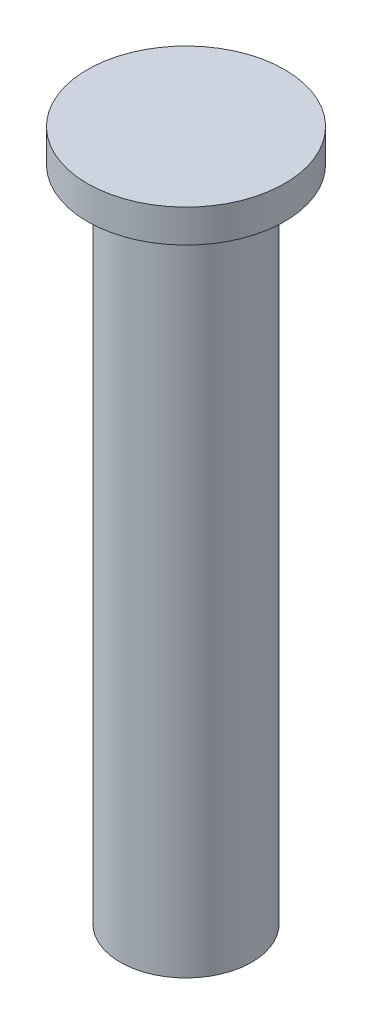
from build123d import *


with BuildPart() as part:
    # Sketch2 → Revolve1 (revolve)
    with BuildSketch(Plane.XY, mode=Mode.PRIVATE) as revolve1_sk:
        Polygon((0, 0), (0, 1050), (150, 1050), (150, 1000), (100, 1000), (100, 0), align=None)
    revolve(revolve1_sk.sketch.rotate(Axis((0, 0, 0), (0, 1, 0)), 90), axis=Axis((0, 0, 0), (0, 1, 0)))


solid = part.part
